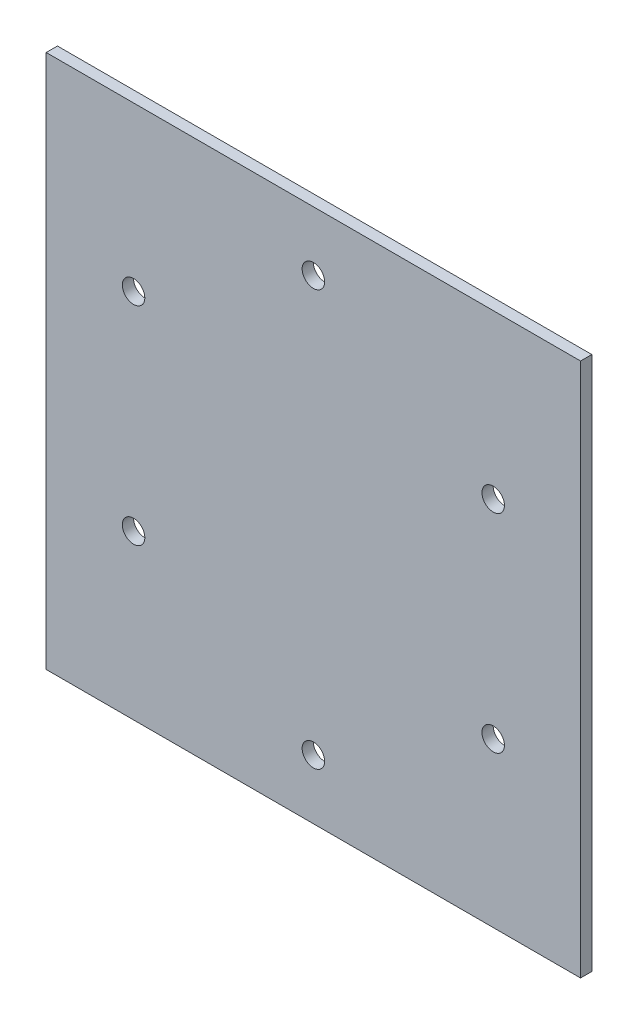
from build123d import *

# Parameters (mm, degrees)
CROQUIS1_W              = 190
CROQUIS1_H              = 190
SALIENTE_EXTRUIR1_DEPTH = 2
CROQUIS2_R              = 4
CORTAR_EXTRUIR2_DEPTH   = 4


with BuildPart() as part:
    # Croquis1 → Saliente-Extruir1 (new, symmetric)
    with BuildSketch(Plane.XY):
        with Locations((95, 95)):
            Rectangle(CROQUIS1_W, CROQUIS1_H)
    extrude(amount=SALIENTE_EXTRUIR1_DEPTH, both=True)

    # Croquis2 → Cortar-Extruir2 (cut)
    with BuildSketch(Plane.XY.offset(2)):
        with Locations((95, 168.86)):
            Circle(CROQUIS2_R)
        with Locations((158.938655561, 131.945)):
            Circle(CROQUIS2_R)
        with Locations((158.938655561, 58.115)):
            Circle(CROQUIS2_R)
        with Locations((95, 21.2)):
            Circle(CROQUIS2_R)
        with Locations((31.061344439, 58.115)):
            Circle(CROQUIS2_R)
        with Locations((31.061344439, 131.945)):
            Circle(CROQUIS2_R)
    extrude(amount=-CORTAR_EXTRUIR2_DEPTH, mode=Mode.SUBTRACT)


solid = part.part
